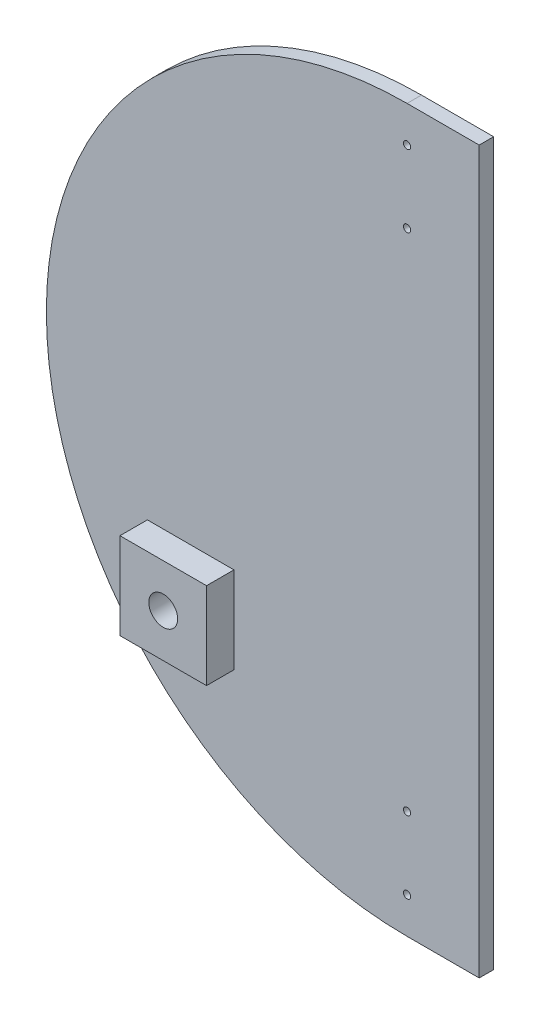
from build123d import *

# Parameters (mm, degrees)
SKETCH_1_R          = 1.25
SKETCH_1_R_2        = 5
EXTRUDE_1_DEPTH     = 5
SKETCH_2_W          = 30
SKETCH_2_H          = 30
EXTRUDE_2_DEPTH     = 9.5
SKETCH_3_R          = 5
CUT_EXTRUDE_1_DEPTH = 9.5


with BuildPart() as part:
    # 草图1 → 凸台-拉伸1 (new body)
    with BuildSketch(Plane.XY):
        with BuildLine():
            Line((0, 125), (25, 125))
            Line((25, 125), (25, -125))
            Line((25, -125), (0, -125))
            ThreePointArc((0, -125), (-125, 0), (0, 125))
        make_face()
        with Locations((0, 112.5)):
            Circle(SKETCH_1_R, mode=Mode.SUBTRACT)
        with Locations((0, 87.5)):
            Circle(SKETCH_1_R, mode=Mode.SUBTRACT)
        with Locations(Location((0, -87.5, 0), (0, 0, 180))):
            Circle(SKETCH_1_R, mode=Mode.SUBTRACT)
        with Locations(Location((0, -112.5, 0), (0, 0, 180))):
            Circle(SKETCH_1_R, mode=Mode.SUBTRACT)
        with Locations((-75, -60)):
            Circle(SKETCH_1_R_2, mode=Mode.SUBTRACT)
    extrude(amount=EXTRUDE_1_DEPTH)

    # 草图2 → 凸台-拉伸2 (add)
    with BuildSketch(Plane.XY.offset(5)):
        with Locations((-75, -60)):
            Rectangle(SKETCH_2_W, SKETCH_2_H)
    extrude(amount=EXTRUDE_2_DEPTH)

    # 草图3 → 切除-拉伸1 (cut)
    with BuildSketch(Plane(origin=(0, 0, 5), x_dir=(-1, 0, 0), z_dir=(0, 0, -1))):
        with Locations((75, -60)):
            Circle(SKETCH_3_R)
    extrude(amount=-CUT_EXTRUDE_1_DEPTH, mode=Mode.SUBTRACT)


solid = part.part
